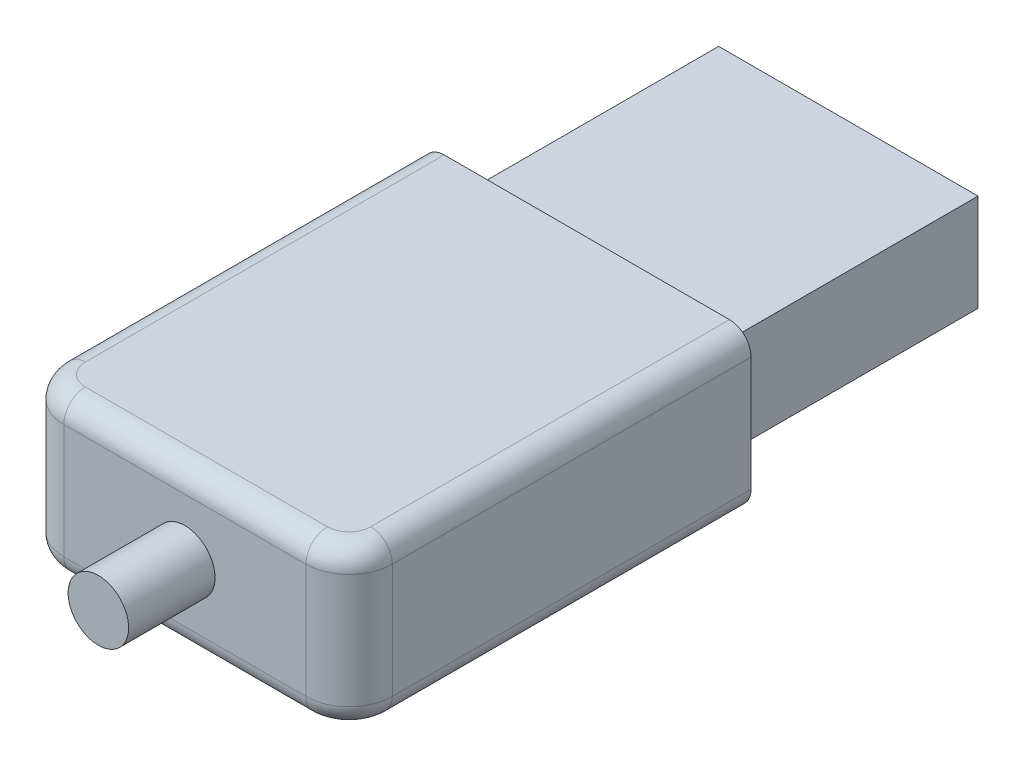
from build123d import *
from OCP.BRepFilletAPI import BRepFilletAPI_MakeFillet

# Parameters (mm, degrees)
ESQUISSE1_W             = 15.2
ESQUISSE1_H             = 7.3
BOSS_EXTRU_1_DEPTH      = 18.6
ESQUISSE2_W             = 12
ESQUISSE2_H             = 4.5
BOSS_EXTRU_2_DEPTH      = 12.1
ESQUISSE3_W             = 11.6
ESQUISSE3_H             = 2.2
ENL_V_MAT_EXTRU_1_DEPTH = 9
ESQUISSE4_R             = 1.4
BOSS_EXTRU_3_DEPTH      = 4
CONG_1_R1               = 1
CONG_1_R2               = 2


with BuildPart() as part:
    # Esquisse1 → Boss.-Extru.1 (new body)
    with BuildSketch(Plane.XY):
        Rectangle(ESQUISSE1_W, ESQUISSE1_H)
    extrude(amount=BOSS_EXTRU_1_DEPTH)

    # Esquisse2 → Boss.-Extru.2 (add)
    with BuildSketch(Plane(origin=(0, 0, 0), x_dir=(-1, 0, 0), z_dir=(0, 0, -1))):
        Rectangle(ESQUISSE2_W, ESQUISSE2_H)
    extrude(amount=BOSS_EXTRU_2_DEPTH)

    # Esquisse3 → Enlèv. mat.-Extru.1 (cut)
    with BuildSketch(Plane(origin=(0, 0, -12.1), x_dir=(-1, 0, 0), z_dir=(0, 0, -1))):
        with Locations((0, 0.95)):
            Rectangle(ESQUISSE3_W, ESQUISSE3_H)
    extrude(amount=-ENL_V_MAT_EXTRU_1_DEPTH, mode=Mode.SUBTRACT)

    # Esquisse4 → Boss.-Extru.3 (add)
    with BuildSketch(Plane.XY.offset(18.6)):
        Circle(ESQUISSE4_R)
    extrude(amount=BOSS_EXTRU_3_DEPTH)

    # Congé1: one fillet with a radius per group of edges: ONE call of the kernel's fillet builder (fillet() takes one radius for all edges)
    cong_1_edges_1 = [part.edges().sort_by_distance(p)[0] for p in [
        (-7.6, 3.65, 9.3),
        (7.6, 3.65, 9.3),
        (7.6, -3.65, 9.3),
        (-7.6, -3.65, 9.3),
        (0, -3.65, 18.6),
        (0, 3.65, 18.6),
    ]]
    cong_1_edges_2 = [part.edges().sort_by_distance(p)[0] for p in [
        (-7.6, 0, 18.6),
        (7.6, 0, 18.6),
    ]]
    cong_1 = BRepFilletAPI_MakeFillet(part.part.solid().wrapped)
    for e in cong_1_edges_1:
        cong_1.Add(CONG_1_R1, e.wrapped)
    for e in cong_1_edges_2:
        cong_1.Add(CONG_1_R2, e.wrapped)
    add(Compound.cast(cong_1.Shape()), mode=Mode.REPLACE)


solid = part.part
